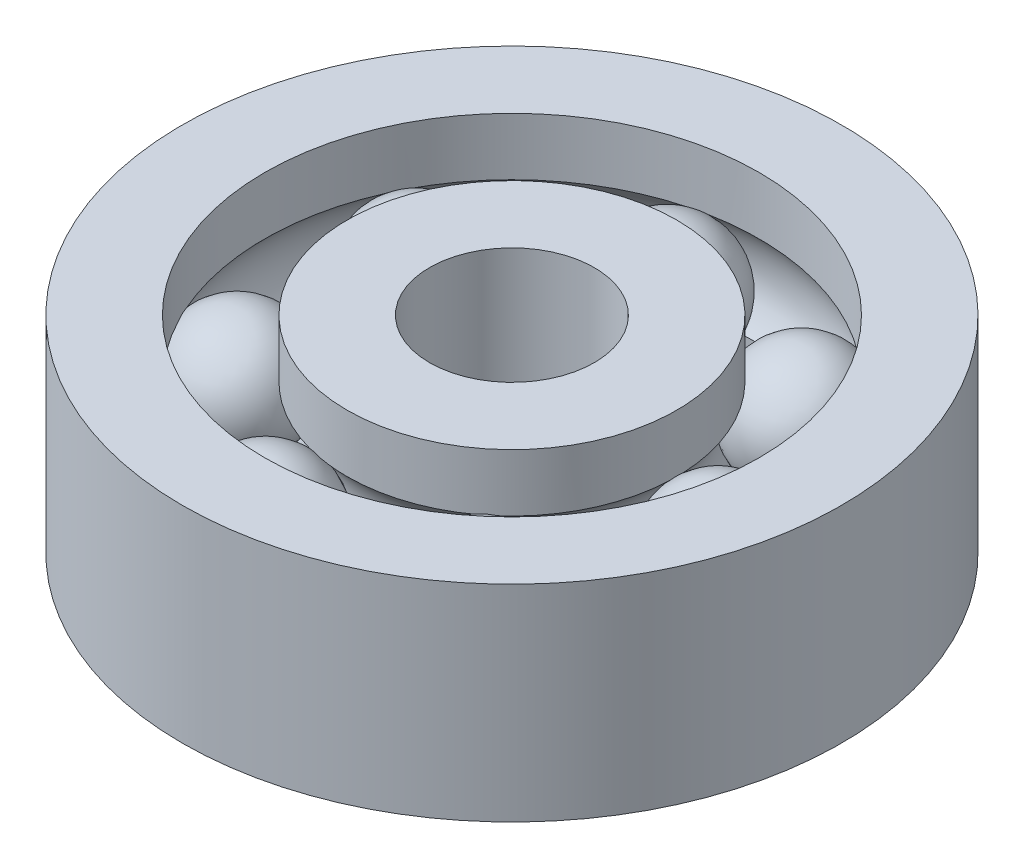
from build123d import *

# Parameters (mm, degrees)
PATTERN_CIRCULAR_1_COUNT = 7


with BuildPart() as part:
    # 草图2 → 旋转2 (revolve)
    with BuildSketch(Plane.XY, mode=Mode.PRIVATE) as revolve_2_sk:
        with BuildLine():
            Line((4, 5), (2, 5))
            Line((2, 5), (2, 0))
            Line((2, 0), (4, 0))
            Line((4, 0), (4, 1.395418631))
            ThreePointArc((4, 1.395418631), (3.51, 2.5), (4, 3.604581369))
            Line((4, 3.604581369), (4, 5))
        make_face()
    revolve(revolve_2_sk.sketch.rotate(Axis((0, 3.696428571, 0), (0, -1, 0)), 90), axis=Axis((0, 3.696428571, 0), (0, -1, 0)))



with BuildPart() as body_2:
    # 草图4 → 旋转3 (revolve)
    with BuildSketch(Plane.XY, mode=Mode.PRIVATE) as revolve_3_sk:
        with BuildLine():
            Line((6, 3.604581369), (6, 5))
            Line((6, 5), (8, 5))
            Line((8, 5), (8, 0))
            Line((8, 0), (6, 0))
            Line((6, 0), (6, 1.395418631))
            ThreePointArc((6, 1.395418631), (6.49, 2.5), (6, 3.604581369))
        make_face()
    revolve(revolve_3_sk.sketch.rotate(Axis((0, 2.622722823, 0), (0, -1, 0)), 90), axis=Axis((0, 2.622722823, 0), (0, -1, 0)))


with BuildPart() as part_1:
    add(part.part)

    add(body_2.part)  # 旋转4 merges body 2
    # 草图1 → 旋转4 (revolve)
    with BuildSketch(Plane.XY):
        with BuildLine():
            Line((5, 4), (5, 1))
            ThreePointArc((5, 1), (6.5, 2.5), (5, 4))
        make_face()
    revolve_4 = revolve(axis=Axis((5, 4, 0), (0, -1, 0)))

    # 阵列(圆周)1: 旋转4 ×7 about axis
    pattern_circular_1_axis = Axis((0, 0, 0), (0, 1, 0))
    for i in range(1, PATTERN_CIRCULAR_1_COUNT):
        add(revolve_4.rotate(pattern_circular_1_axis, i * 360 / PATTERN_CIRCULAR_1_COUNT))


solid = part_1.part
